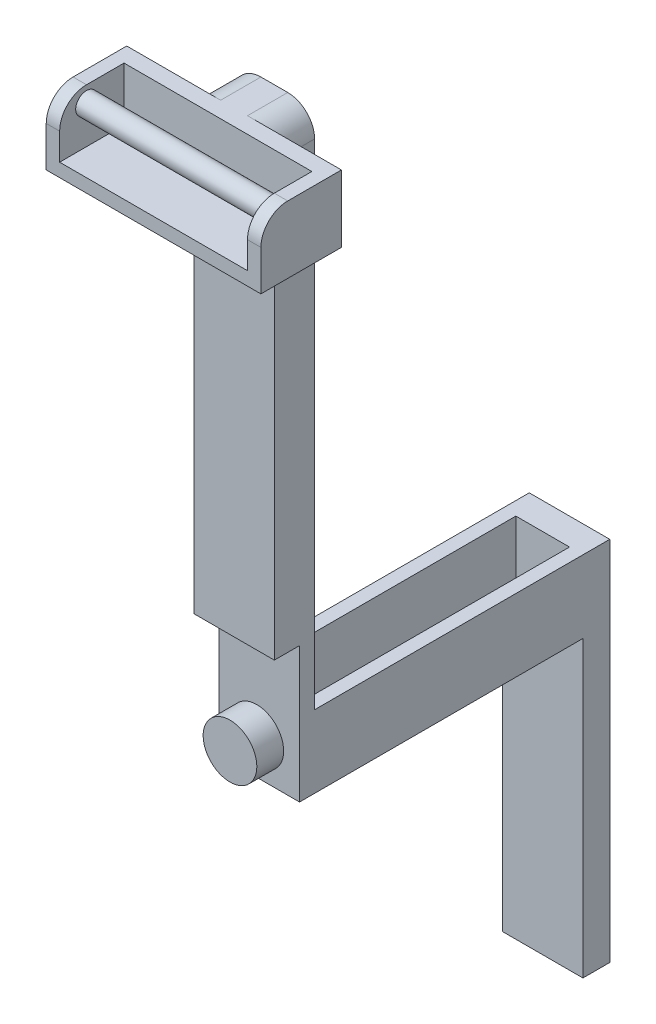
from build123d import *

# Parameters (mm, degrees)
SKETCH1_W                       = 30
SKETCH1_H                       = 194.2
SKETCH1_H_2                     = 27
SKETCH1_H_3                     = 261.4
EXTRUDE1_DEPTH                  = 15
FILLET1_R                       = 10
EXTRUDE2_DEPTH                  = 10
SKETCH3_W                       = 80
SKETCH3_H                       = 25
EXTRUDE3_DEPTH                  = 30
SKETCH5_W                       = 70
SKETCH5_H                       = 20
EXTRUDE4_DEPTH                  = 24
FILLET2_R                       = 10
EXTRUDE5_REACH                  = 432.349
SKETCH6_R                       = 4.029178008
SKETCH7_W                       = 30
SKETCH7_H                       = 263.372286267
EXTRUDE6_DEPTH                  = 427.91910061
EXTRUDE7_DEPTH                  = 100
SKETCH9_W                       = 30
SKETCH9_H                       = 136.58118173
EXTRUDE8_DEPTH                  = 10
F_1_4_0_25_DIAMETER_HOLE1_D     = 6.35
F_1_4_0_25_DIAMETER_HOLE1_DEPTH = 10
F_1_4_0_25_DIAMETER_HOLE1_TIP   = 1.907732465
EXTRUDE10_DEPTH                 = 439.560051151
EXTRUDE10_DEPTH_BACK            = 439.560051151
SKETCH11_W                      = 9.397052114
SKETCH11_H                      = 50.5
SKETCH12_R                      = 10
EXTRUDE11_DEPTH                 = 10


with BuildPart() as part:
    # Sketch1 → Extrude1 (new body)
    with BuildSketch(Plane.XY):
        with Locations((15, 322.665015772)):
            Rectangle(SKETCH1_W, SKETCH1_H)
        with BuildLine():
            Line((30, 225.565015772), (30, 198.565015772))
            Line((30, 198.565015772), (50, 198.565015772))
            ThreePointArc((50, 198.565015772), (63.5, 212.065015772), (50, 225.565015772))
            Line((50, 225.565015772), (30, 225.565015772))
        make_face()
        with Locations((15, 212.065015772)):
            Rectangle(SKETCH1_W, SKETCH1_H_2)
        with BuildLine():
            Line((-20, 198.565015772), (0, 198.565015772))
            Line((0, 198.565015772), (0, 225.565015772))
            Line((0, 225.565015772), (-20, 225.565015772))
            ThreePointArc((-20, 225.565015772), (-33.5, 212.065015772), (-20, 198.565015772))
        make_face()
        with Locations((15, 67.865015772)):
            Rectangle(SKETCH1_W, SKETCH1_H_3)
    extrude(amount=EXTRUDE1_DEPTH)

    # Fillet1
    fillet1_edges = [part.edges().sort_by_distance(p)[0] for p in [
        (0, 419.765015772, 7.5),
        (30, 419.765015772, 7.5),
        (30, -62.834984228, 7.5),
        (0, -62.834984228, 7.5),
    ]]
    fillet(fillet1_edges, radius=FILLET1_R)

    # Sketch2 → Extrude2 (cut)
    with BuildSketch(Plane(origin=(0, 0, 0), x_dir=(-1, 0, 0), z_dir=(0, 0, -1))):
        with BuildLine():
            Line((-50, 225.565015772), (-30, 225.565015772))
            Line((-30, 225.565015772), (-30, 198.565015772))
            Line((-30, 198.565015772), (-50, 198.565015772))
            ThreePointArc((-50, 198.565015772), (-63.5, 212.065015772), (-50, 225.565015772))
        make_face()
        with BuildLine():
            Line((0, 198.565015772), (20, 198.565015772))
            ThreePointArc((20, 198.565015772), (33.5, 212.065015772), (20, 225.565015772))
            Line((20, 225.565015772), (0, 225.565015772))
            Line((0, 225.565015772), (0, 198.565015772))
        make_face()
    extrude(amount=-EXTRUDE2_DEPTH, mode=Mode.SUBTRACT)

    # Sketch3 → Extrude3 (add)
    with BuildSketch(Plane.XY.offset(15)):
        with Locations((15, 407.265015772)):
            Rectangle(SKETCH3_W, SKETCH3_H)
    extrude(amount=EXTRUDE3_DEPTH)

    # Sketch5 → Extrude4 (cut)
    with BuildSketch(Plane.XY.offset(45)):
        with Locations((15, 409.765015772)):
            Rectangle(SKETCH5_W, SKETCH5_H)
    extrude(amount=-EXTRUDE4_DEPTH, mode=Mode.SUBTRACT)

    # Fillet2
    fillet2_edges = [part.edges().sort_by_distance(p)[0] for p in [
        (52.5, 419.765015772, 45),
        (-22.5, 419.765015772, 45),
    ]]
    fillet(fillet2_edges, radius=FILLET2_R)

    # Sketch6 → Extrude5 (add, up to next)
    with BuildSketch(Plane.ZY.offset(-50), mode=Mode.PRIVATE) as extrude5_sk1:
        with Locations(Location((35, 413.847695375, 0), (0, 0, 180))):
            Circle(SKETCH6_R)
    extrude5_tool1 = extrude(extrude5_sk1.sketch, amount=EXTRUDE5_REACH, mode=Mode.PRIVATE) - part.part
    add(extrude5_tool1.solids().sort_by_distance((50, 413.847695, 35))[0])

    # Sketch7 → Extrude6 (cut, through all)
    with BuildSketch(Plane(origin=(0, 0, 0), x_dir=(-1, 0, 0), z_dir=(0, 0, -1))):
        with Locations((-15, 66.878872639)):
            Rectangle(SKETCH7_W, SKETCH7_H)
    extrude(amount=-EXTRUDE6_DEPTH, mode=Mode.SUBTRACT)

    # Sketch8 → Extrude7 (add)
    with BuildSketch(Plane(origin=(0, 0, 0), x_dir=(-1, 0, 0), z_dir=(0, 0, -1))):
        Polygon((-30, 198.565015772), (0, 198.565015772), (0, 225.565015772), (-5, 225.565015772), (-5, 203.565015772), (-25, 203.565015772), (-25, 225.565015772), (-30, 225.565015772), align=None)
    extrude(amount=EXTRUDE7_DEPTH)

    # Sketch9 → Extrude8 (add)
    with BuildSketch(Plane(origin=(0, 0, -100), x_dir=(-1, 0, 0), z_dir=(0, 0, -1))):
        with Locations((-15, 157.274424907)):
            Rectangle(SKETCH9_W, SKETCH9_H)
    extrude(amount=EXTRUDE8_DEPTH)

    # 1/4 (0.25) Diameter Hole1
    with Locations(Plane(origin=(-20, 212.065015772, 10), x_dir=(-1, 0, 0), z_dir=(0, 0, -1))):
        with Locations((0, 0), (-70, 0)):
            Hole(F_1_4_0_25_DIAMETER_HOLE1_D / 2, depth=F_1_4_0_25_DIAMETER_HOLE1_DEPTH)
            with Locations((0, 0, -(F_1_4_0_25_DIAMETER_HOLE1_DEPTH + F_1_4_0_25_DIAMETER_HOLE1_TIP / 2))):  # 118° drill point
                Cone(0, F_1_4_0_25_DIAMETER_HOLE1_D / 2, F_1_4_0_25_DIAMETER_HOLE1_TIP, mode=Mode.SUBTRACT)

    # Sketch11 → Extrude10 (cut, two sides: drawn at the far end of the back side and taken through both)
    with BuildSketch(Plane(origin=(30, 0, 0), x_dir=(0, 0, -1), z_dir=(1, 0, 0)).offset(-EXTRUDE10_DEPTH_BACK)):
        with Locations((-10.301473943, 223.815015772)):
            Rectangle(SKETCH11_W, SKETCH11_H)
    extrude(amount=EXTRUDE10_DEPTH + EXTRUDE10_DEPTH_BACK, mode=Mode.SUBTRACT)

    # Sketch12 → Extrude11 (add)
    with BuildSketch(Plane.XY.offset(5.602947886)):
        with Locations(Location((14.080124671, 212.060594596, 0), (0, 0, 90))):
            Circle(SKETCH12_R)
    extrude(amount=EXTRUDE11_DEPTH)


solid = part.part
